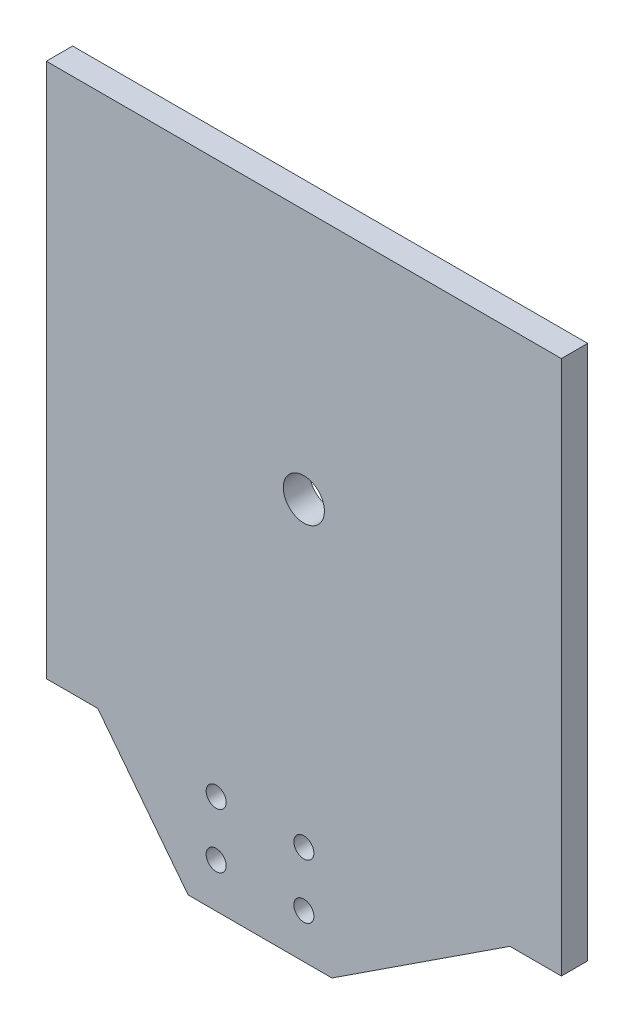
from build123d import *

# Parameters (mm, degrees)
SKETCH1_R           = 4.7625
SKETCH1_R_2         = 2.3241
BOSS_EXTRUDE1_DEPTH = 6.096


with BuildPart() as part:
    # Sketch1 → Boss-Extrude1 (new body)
    with BuildSketch(Plane.XY):
        Polygon((0, 0), (0, 116.205), (119.38, 116.205), (119.38, 0), (119.38, -7.747), (107.442, -7.747), (66.19875, -34.7218), (32.86125, -34.7218), (11.938, -7.747), (0, -7.747), align=None)
        with Locations(Location((59.69, 58.1025, 0), (0, 0, 180))):
            Circle(SKETCH1_R, mode=Mode.SUBTRACT)
        with Locations(Location((39.37, -11.7475, 0), (0, 0, 180))):
            Circle(SKETCH1_R_2, mode=Mode.SUBTRACT)
        with Locations(Location((59.69, -11.7475, 0), (0, 0, 180))):
            Circle(SKETCH1_R_2, mode=Mode.SUBTRACT)
        with Locations(Location((59.69, -24.4475, 0), (0, 0, 180))):
            Circle(SKETCH1_R_2, mode=Mode.SUBTRACT)
        with Locations(Location((39.37, -24.4475, 0), (0, 0, 180))):
            Circle(SKETCH1_R_2, mode=Mode.SUBTRACT)
    extrude(amount=BOSS_EXTRUDE1_DEPTH)


solid = part.part
